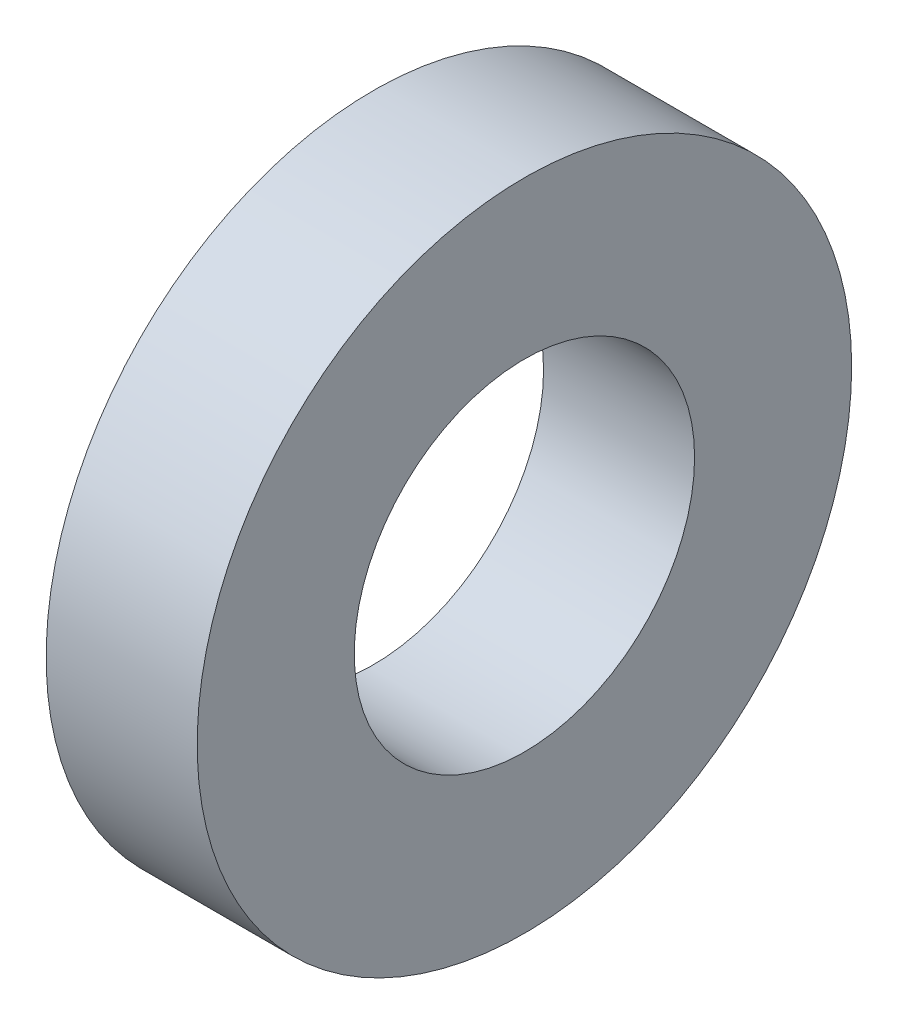
from build123d import *

# Parameters (mm, degrees)
SKETCH1_R           = 32.5
SKETCH1_R_2         = 16.9
BOSS_EXTRUDE1_DEPTH = 15


with BuildPart() as part:
    # Sketch1 → Boss-Extrude1 (new body)
    with BuildSketch(Plane(origin=(0, 0, 0), x_dir=(0, 0, -1), z_dir=(1, 0, 0))):
        Circle(SKETCH1_R)
        Circle(SKETCH1_R_2, mode=Mode.SUBTRACT)
    extrude(amount=BOSS_EXTRUDE1_DEPTH)


solid = part.part
